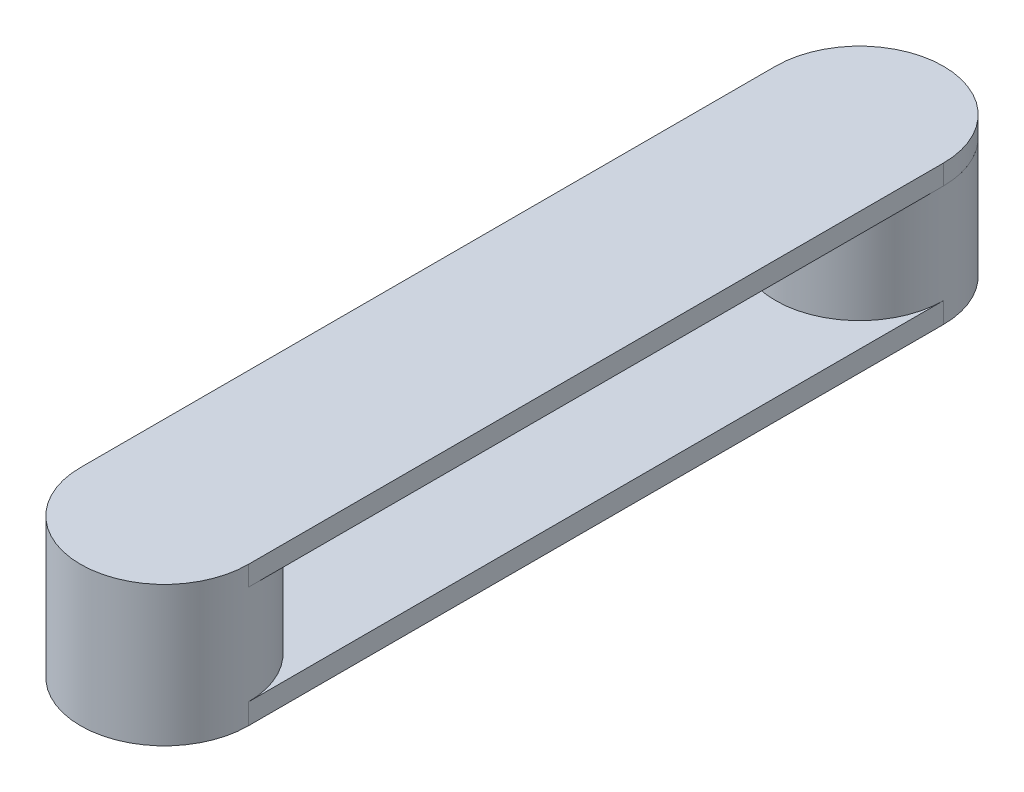
from build123d import *

# Parameters (mm, degrees)
BOSS_EXTRUDE3_DEPTH      = 19.844397107
BOSS_EXTRUDE3_DEPTH_BACK = 1
SKETCH4_R                = 84.5
BOSS_EXTRUDE4_DEPTH      = 100
SKETCH6_R                = 84.5
BOSS_EXTRUDE6_DEPTH      = 100
BOSS_EXTRUDE7_DEPTH      = 20


with BuildPart() as part:
    # Sketch3 → Boss-Extrude3 (new, two sides: drawn at the far end of the back side and taken through both)
    with BuildSketch(Plane(origin=(0, 0, 0), x_dir=(1, 0, 0), z_dir=(0, 1, 0)).offset(-BOSS_EXTRUDE3_DEPTH_BACK)):
        with BuildLine():
            ThreePointArc((-84.5, 140.346835397), (0, 55.846835397), (84.5, 140.346835397))
            Line((84.5, 140.346835397), (-84.5, 140.346835397))
        make_face()
        with BuildLine():
            Line((-84.5, 140.346835397), (84.5, 140.346835397))
            ThreePointArc((84.5, 140.346835397), (0, 224.846835397), (-84.5, 140.346835397))
        make_face()
        with BuildLine():
            ThreePointArc((-84.5, 140.346835397), (0, 224.846835397), (84.5, 140.346835397))
            Line((84.5, 140.346835397), (84.5, 840.346835397))
            ThreePointArc((84.5, 840.346835397), (0, 755.846835397), (-84.5, 840.346835397))
            Line((-84.5, 840.346835397), (-84.5, 140.346835397))
        make_face()
        with BuildLine():
            ThreePointArc((-84.5, 840.346835397), (0, 755.846835397), (84.5, 840.346835397))
            Line((84.5, 840.346835397), (-84.5, 840.346835397))
        make_face()
        with BuildLine():
            Line((-84.5, 840.346835397), (84.5, 840.346835397))
            ThreePointArc((84.5, 840.346835397), (0, 924.846835397), (-84.5, 840.346835397))
        make_face()
    extrude(amount=BOSS_EXTRUDE3_DEPTH + BOSS_EXTRUDE3_DEPTH_BACK)

    # Sketch4 → Boss-Extrude4 (add)
    with BuildSketch(Plane(origin=(0, 19.844397107, 0), x_dir=(1, 0, 0), z_dir=(0, 1, 0))):
        with Locations(Location((0, 140.346835397, 0), (0, 0, 270))):
            Circle(SKETCH4_R)
    extrude(amount=BOSS_EXTRUDE4_DEPTH)

    # Sketch6 → Boss-Extrude6 (add)
    with BuildSketch(Plane(origin=(0, 19.844397107, 0), x_dir=(1, 0, 0), z_dir=(0, 1, 0))):
        with Locations(Location((0, 840.346835397, 0), (0, 0, 270))):
            Circle(SKETCH6_R)
    extrude(amount=BOSS_EXTRUDE6_DEPTH)

    # Sketch7 → Boss-Extrude7 (add)
    with BuildSketch(Plane(origin=(0, 119.844397107, 0), x_dir=(1, 0, 0), z_dir=(0, 1, 0))):
        with BuildLine():
            ThreePointArc((-84.5, 140.346835397), (0, 55.846835397), (84.5, 140.346835397))
            Line((84.5, 140.346835397), (-84.5, 140.346835397))
        make_face()
        with BuildLine():
            Line((-84.5, 140.346835397), (84.5, 140.346835397))
            ThreePointArc((84.5, 140.346835397), (0, 224.846835397), (-84.5, 140.346835397))
        make_face()
        with BuildLine():
            ThreePointArc((-84.5, 140.346835397), (0, 224.846835397), (84.5, 140.346835397))
            Line((84.5, 140.346835397), (84.5, 840.32890922))
            ThreePointArc((84.5, 840.32890922), (0, 755.82890922), (-84.5, 840.32890922))
            Line((-84.5, 840.32890922), (-84.5, 140.346835397))
        make_face()
        with BuildLine():
            ThreePointArc((-84.5, 840.32890922), (0, 755.82890922), (84.5, 840.32890922))
            Line((84.5, 840.32890922), (-84.5, 840.32890922))
        make_face()
        with BuildLine():
            Line((-84.5, 840.32890922), (84.5, 840.32890922))
            ThreePointArc((84.5, 840.32890922), (0, 924.82890922), (-84.5, 840.32890922))
        make_face()
    extrude(amount=BOSS_EXTRUDE7_DEPTH)


solid = part.part
